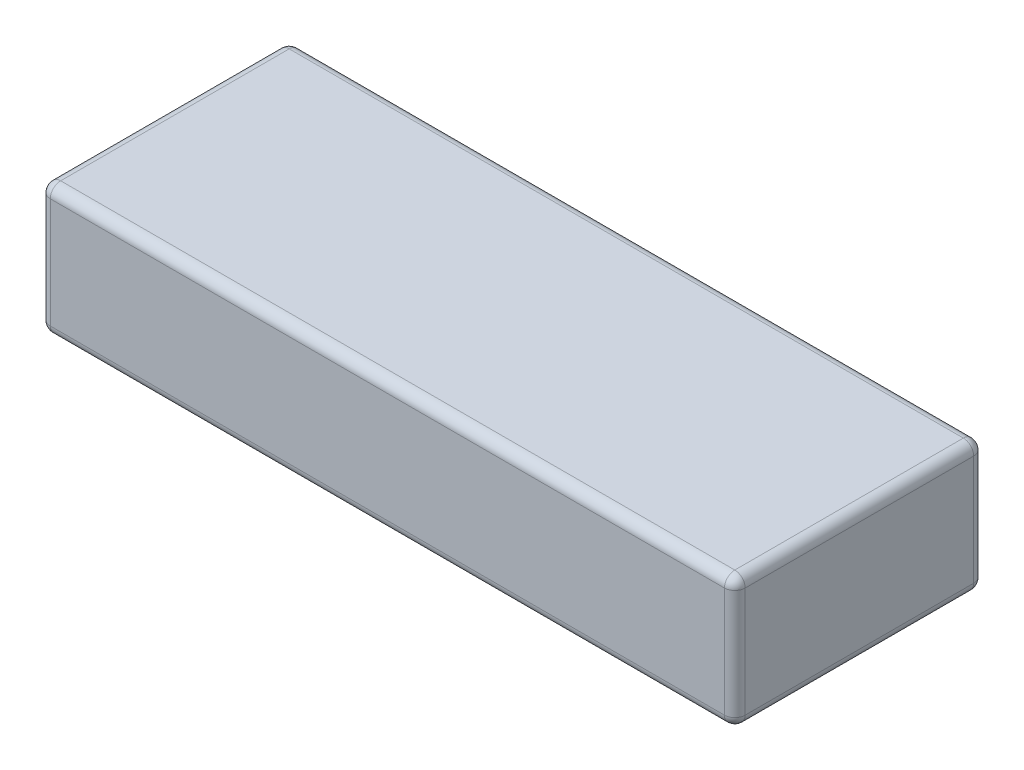
from build123d import *

# Parameters (mm, degrees)
SKETCH1_W           = 169.926
SKETCH1_H           = 60.96
BOSS_EXTRUDE1_DEPTH = 32.004
FILLET1_R           = 2.54


with BuildPart() as part:
    # Sketch1 → Boss-Extrude1 (new body)
    with BuildSketch(Plane(origin=(0, 0, 0), x_dir=(1, 0, 0), z_dir=(0, 1, 0))):
        Rectangle(SKETCH1_W, SKETCH1_H)
    extrude(amount=BOSS_EXTRUDE1_DEPTH)

    # Fillet1
    fillet1_edges = [part.edges().sort_by_distance(p)[0] for p in [
        (-84.963, 32.004, 0),
        (0, 32.004, 30.48),
        (84.963, 32.004, 0),
        (0, 0, 30.48),
        (-84.963, 0, 0),
        (0, 0, -30.48),
        (84.963, 0, 0),
        (0, 32.004, -30.48),
        (84.963, 16.002, 30.48),
        (-84.963, 16.002, 30.48),
        (-84.963, 16.002, -30.48),
        (84.963, 16.002, -30.48),
    ]]
    fillet(fillet1_edges, radius=FILLET1_R)


solid = part.part
